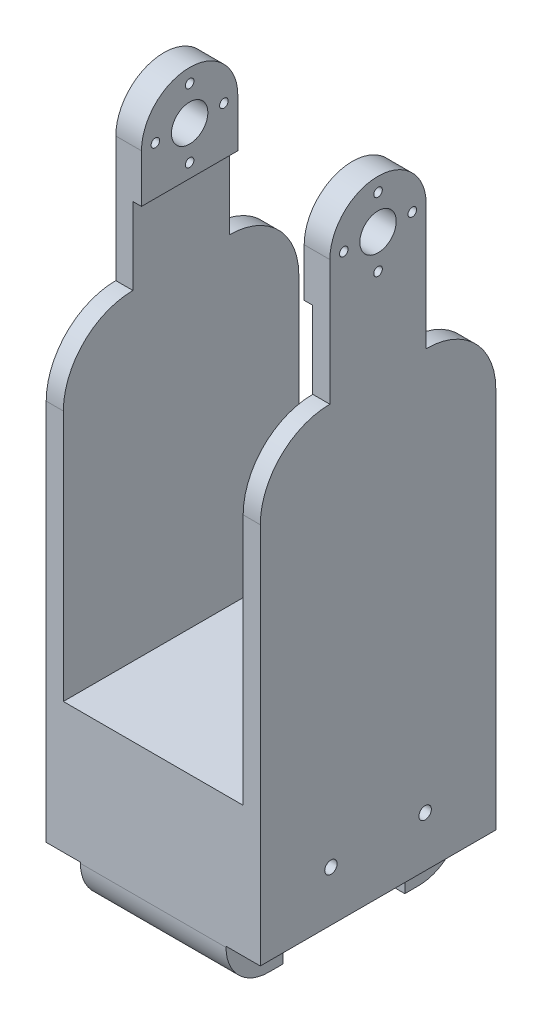
from build123d import *

# Parameters (mm, degrees)
SKETCH1_W           = 50
SKETCH1_H           = 170
BOSS_EXTRUDE1_DEPTH = 55
SKETCH2_W           = 34
SKETCH2_H           = 27
CUT_EXTRUDE1_DEPTH  = 181.416185527
SKETCH3_W           = 10
SKETCH3_H           = 24
SKETCH3_R           = 4.25
SKETCH3_R_2         = 1
CUT_EXTRUDE2_DEPTH  = 186.539753153
SKETCH4_W           = 2
SKETCH4_H           = 24
CUT_EXTRUDE3_DEPTH  = 178.623196683
SKETCH5_W           = 6.25
SKETCH5_H           = 11.25
CUT_EXTRUDE4_DEPTH  = 186.539753153
SKETCH6_W           = 38
SKETCH6_H           = 10
CUT_EXTRUDE5_DEPTH  = 181.416185527
SKETCH8_W           = 13.25
SKETCH8_H           = 2.25
CUT_EXTRUDE7_DEPTH  = 186.539753153
SKETCH9_W           = 34
SKETCH9_H           = 35.25
CUT_EXTRUDE8_DEPTH  = 179.297679458
SKETCH11_W          = 13.25
SKETCH11_H          = 20.25
CUT_EXTRUDE9_DEPTH  = 184.480414486
SKETCH12_W          = 28.5
SKETCH12_H          = 15
BOSS_EXTRUDE2_DEPTH = 8
SKETCH14_W          = 34
SKETCH14_H          = 15
SKETCH14_H_2        = 10.25
BOSS_EXTRUDE3_DEPTH = 13.25
SKETCH16_R          = 4.5
SKETCH16_R_2        = 2.5
CUT_EXTRUDE13_DEPTH = 8
SKETCH17_W          = 16.25
SKETCH17_H          = 18
CUT_EXTRUDE14_DEPTH = 175.384811552
CUT_EXTRUDE15_DEPTH = 175.384811552
SKETCH20_W          = 42
SKETCH20_H          = 6.25
SKETCH20_H_2        = 18
SKETCH20_H_3        = 58.75
CUT_EXTRUDE18_DEPTH = 169.923244404
SKETCH22_R          = 4.5
SKETCH22_R_2        = 1.45
BOSS_EXTRUDE4_DEPTH = 8
SKETCH23_W          = 2
SKETCH23_H          = 10
CUT_EXTRUDE19_DEPTH = 165.352137193
FILLET1_R           = 10


with BuildPart() as part:
    # Sketch1 → Boss-Extrude1 (new body)
    with BuildSketch(Plane.XY):
        with Locations((0, -85)):
            Rectangle(SKETCH1_W, SKETCH1_H)
    extrude(amount=-BOSS_EXTRUDE1_DEPTH)

    # Sketch2 → Cut-Extrude1 (cut, through all)
    with BuildSketch(Plane.XY):
        with Locations((0, -13.5)):
            Rectangle(SKETCH2_W, SKETCH2_H)
    extrude(amount=-CUT_EXTRUDE1_DEPTH, mode=Mode.SUBTRACT)

    # Sketch3 → Cut-Extrude2 (cut, through all)
    with BuildSketch(Plane(origin=(25, 0, 0), x_dir=(0, 0, -1), z_dir=(1, 0, 0))):
        with Locations((50, -12)):
            Rectangle(SKETCH3_W, SKETCH3_H)
        with Locations((5, -12)):
            Rectangle(SKETCH3_W, SKETCH3_H)
        with Locations(Location((27.5, -12.75, 0), (0, 0, 90))):
            Circle(SKETCH3_R)
        with Locations(Location((35.5, -12.75, 0), (0, 0, 90))):
            Circle(SKETCH3_R_2)
        with Locations(Location((27.5, -4.75, 0), (0, 0, 90))):
            Circle(SKETCH3_R_2)
        with Locations(Location((27.5, -20.75, 0), (0, 0, 90))):
            Circle(SKETCH3_R_2)
        with Locations(Location((19.5, -12.75, 0), (0, 0, 90))):
            Circle(SKETCH3_R_2)
    extrude(amount=-CUT_EXTRUDE2_DEPTH, mode=Mode.SUBTRACT)

    # Sketch4 → Cut-Extrude3 (cut, through all)
    with BuildSketch(Plane.XY.offset(-10)):
        with Locations((-18, -12)):
            Rectangle(SKETCH4_W, SKETCH4_H)
        with Locations((18, -12)):
            Rectangle(SKETCH4_W, SKETCH4_H)
    extrude(amount=-CUT_EXTRUDE3_DEPTH, mode=Mode.SUBTRACT)

    # Sketch5 → Cut-Extrude4 (cut, through all)
    with BuildSketch(Plane(origin=(25, 0, 0), x_dir=(0, 0, -1), z_dir=(1, 0, 0))):
        with BuildLine():
            Line((45, 0), (10, 0))
            Line((10, 0), (10, -12.75))
            Line((10, -12.75), (16.25, -12.75))
            ThreePointArc((16.25, -12.75), (27.5, -1.5), (38.75, -12.75))
            Line((38.75, -12.75), (45, -12.75))
            Line((45, -12.75), (45, 0))
        make_face()
        with Locations((13.125, -18.375)):
            Rectangle(SKETCH5_W, SKETCH5_H)
        with Locations((41.875, -18.375)):
            Rectangle(SKETCH5_W, SKETCH5_H)
    extrude(amount=-CUT_EXTRUDE4_DEPTH, mode=Mode.SUBTRACT)

    # Sketch6 → Cut-Extrude5 (cut, through all)
    with BuildSketch(Plane.XY):
        with Locations((0, -29)):
            Rectangle(SKETCH6_W, SKETCH6_H)
    extrude(amount=-CUT_EXTRUDE5_DEPTH, mode=Mode.SUBTRACT)

    # Sketch8 → Cut-Extrude7 (cut, through all)
    with BuildSketch(Plane(origin=(25, 0, 0), x_dir=(0, 0, -1), z_dir=(1, 0, 0))):
        with BuildLine():
            Line((27.5, -157.5), (27.5, -132.5))
            Line((27.5, -132.5), (13.25, -132.5))
            Line((13.25, -132.5), (13.25, -167.75))
            Line((13.25, -167.75), (17.25, -167.75))
            ThreePointArc((17.25, -167.75), (20.252155493, -160.502155493), (27.5, -157.5))
        make_face()
        with BuildLine():
            Line((41.75, -167.75), (41.75, -132.5))
            Line((41.75, -132.5), (27.5, -132.5))
            Line((27.5, -132.5), (27.5, -157.5))
            ThreePointArc((27.5, -157.5), (34.747844507, -160.502155493), (37.75, -167.75))
            Line((37.75, -167.75), (41.75, -167.75))
        make_face()
        with Locations((48.375, -168.875)):
            Rectangle(SKETCH8_W, SKETCH8_H)
        with Locations((6.625, -168.875)):
            Rectangle(SKETCH8_W, SKETCH8_H)
        with BuildLine():
            Line((17.25, -167.75), (13.25, -167.75))
            Line((13.25, -167.75), (13.25, -170))
            Line((13.25, -170), (17.5, -170))
            ThreePointArc((17.5, -170), (17.31269172, -168.881923142), (17.25, -167.75))
        make_face()
        with BuildLine():
            Line((41.75, -170), (41.75, -167.75))
            Line((41.75, -167.75), (37.75, -167.75))
            ThreePointArc((37.75, -167.75), (37.68730828, -168.881923142), (37.5, -170))
            Line((37.5, -170), (41.75, -170))
        make_face()
        with BuildLine():
            Line((27.5, -167.75), (27.5, -157.5))
            ThreePointArc((27.5, -157.5), (20.252155493, -160.502155493), (17.25, -167.75))
            Line((17.25, -167.75), (27.5, -167.75))
        make_face()
        with BuildLine():
            ThreePointArc((37.75, -167.75), (34.747844507, -160.502155493), (27.5, -157.5))
            Line((27.5, -157.5), (27.5, -167.75))
            Line((27.5, -167.75), (37.75, -167.75))
        make_face()
        with BuildLine():
            Line((27.5, -170), (27.5, -167.75))
            Line((27.5, -167.75), (17.25, -167.75))
            ThreePointArc((17.25, -167.75), (17.31269172, -168.881923142), (17.5, -170))
            Line((17.5, -170), (27.5, -170))
        make_face()
        with BuildLine():
            ThreePointArc((37.5, -170), (37.68730828, -168.881923142), (37.75, -167.75))
            Line((37.75, -167.75), (27.5, -167.75))
            Line((27.5, -167.75), (27.5, -170))
            Line((27.5, -170), (37.5, -170))
        make_face()
    extrude(amount=-CUT_EXTRUDE7_DEPTH, mode=Mode.SUBTRACT)

    # Sketch9 → Cut-Extrude8 (cut, through all)
    with BuildSketch(Plane.XY):
        with Locations((0, -150.125)):
            Rectangle(SKETCH9_W, SKETCH9_H)
    extrude(amount=-CUT_EXTRUDE8_DEPTH, mode=Mode.SUBTRACT)

    # Sketch11 → Cut-Extrude9 (cut, through all)
    with BuildSketch(Plane(origin=(25, 0, 0), x_dir=(0, 0, -1), z_dir=(1, 0, 0))):
        with BuildLine():
            ThreePointArc((17.25, -167.75), (20.252155493, -160.502155493), (27.5, -157.5))
            Line((27.5, -157.5), (27.5, -147.5))
            Line((27.5, -147.5), (13.25, -147.5))
            Line((13.25, -147.5), (13.25, -167.75))
            Line((13.25, -167.75), (17.25, -167.75))
        make_face()
        with BuildLine():
            Line((27.5, -147.5), (27.5, -157.5))
            ThreePointArc((27.5, -157.5), (34.747844507, -160.502155493), (37.75, -167.75))
            Line((37.75, -167.75), (41.75, -167.75))
            Line((41.75, -167.75), (41.75, -147.5))
            Line((41.75, -147.5), (27.5, -147.5))
        make_face()
        with Locations((48.375, -157.625)):
            Rectangle(SKETCH11_W, SKETCH11_H)
        with Locations((6.625, -157.625)):
            Rectangle(SKETCH11_W, SKETCH11_H)
    extrude(amount=-CUT_EXTRUDE9_DEPTH, mode=Mode.SUBTRACT)

    # Sketch12 → Boss-Extrude2 (add)
    with BuildSketch(Plane(origin=(25, 0, 0), x_dir=(0, 0, -1), z_dir=(1, 0, 0))):
        with Locations((27.5, -140)):
            Rectangle(SKETCH12_W, SKETCH12_H)
    boss_extrude2 = extrude(amount=-BOSS_EXTRUDE2_DEPTH)

    # Mirror1: Boss-Extrude2 across plane
    add(boss_extrude2.mirror(Plane(origin=(0, 0, 0), x_dir=(0, 0, 1), z_dir=(1, 0, 0))))

    # Sketch14 → Boss-Extrude3 (add)
    with BuildSketch(Plane.XY):
        with Locations((0, -140)):
            Rectangle(SKETCH14_W, SKETCH14_H)
        with Locations((0, -152.625)):
            Rectangle(SKETCH14_W, SKETCH14_H_2)
    boss_extrude3 = extrude(amount=-BOSS_EXTRUDE3_DEPTH)

    # Mirror2: Boss-Extrude3 across plane
    add(boss_extrude3.mirror(Plane.XY.offset(-27.5)))

    # Sketch16 → Cut-Extrude13 (cut)
    # profile 1 of 3: a face of its own
    with BuildSketch(Plane(origin=(25, 0, 0), x_dir=(0, 0, -1), z_dir=(1, 0, 0))):
        with Locations(Location((16.5, -135.75, 0), (0, 0, 90))):
            Circle(SKETCH16_R)
        with Locations((16.5, -135.75)):
            Circle(SKETCH16_R_2, mode=Mode.SUBTRACT)
    # profile 2 of 3: a face of its own
    with BuildSketch(Plane(origin=(25, 0, 0), x_dir=(0, 0, -1), z_dir=(1, 0, 0))):
        with Locations((16.5, -135.75)):
            Circle(SKETCH16_R_2)
    # profile 3 of 3: a face of its own
    with BuildSketch(Plane(origin=(25, 0, 0), x_dir=(0, 0, -1), z_dir=(1, 0, 0))):
        with Locations(Location((38.5, -135.75, 0), (0, 0, 90))):
            Circle(SKETCH16_R)
    cut_extrude13 = extrude(amount=-CUT_EXTRUDE13_DEPTH, mode=Mode.SUBTRACT)

    # Mirror3: Cut-Extrude13 across plane
    add(cut_extrude13.mirror(Plane(origin=(0, 0, 0), x_dir=(0, 0, 1), z_dir=(1, 0, 0))), mode=Mode.SUBTRACT)

    # Sketch17 → Cut-Extrude14 (cut, through all)
    with BuildSketch(Plane(origin=(25, 0, 0), x_dir=(0, 0, -1), z_dir=(1, 0, 0))):
        with Locations((46.875, -33)):
            Rectangle(SKETCH17_W, SKETCH17_H)
        with Locations((8.125, -33)):
            Rectangle(SKETCH17_W, SKETCH17_H)
    extrude(amount=-CUT_EXTRUDE14_DEPTH, mode=Mode.SUBTRACT)

    # Sketch18 → Cut-Extrude15 (cut, through all)
    with BuildSketch(Plane(origin=(25, 0, 0), x_dir=(0, 0, -1), z_dir=(1, 0, 0))):
        with BuildLine():
            ThreePointArc((0, -58.25), (4.759514806, -46.759514806), (16.25, -42))
            Line((16.25, -42), (0, -42))
            Line((0, -42), (0, -58.25))
        make_face()
        with BuildLine():
            Line((55, -42), (38.75, -42))
            ThreePointArc((38.75, -42), (50.240485194, -46.759514806), (55, -58.25))
            Line((55, -58.25), (55, -42))
        make_face()
    extrude(amount=-CUT_EXTRUDE15_DEPTH, mode=Mode.SUBTRACT)

    # Sketch20 → Cut-Extrude18 (cut, through all)
    with BuildSketch(Plane(origin=(0, 0, -55), x_dir=(-1, 0, 0), z_dir=(0, 0, -1))):
        with Locations((0, -55.125)):
            Rectangle(SKETCH20_W, SKETCH20_H)
        with Locations((0, -43)):
            Rectangle(SKETCH20_W, SKETCH20_H_2)
        with Locations((0, -87.625)):
            Rectangle(SKETCH20_W, SKETCH20_H_3)
    extrude(amount=-CUT_EXTRUDE18_DEPTH, mode=Mode.SUBTRACT)

    # Sketch22 → Boss-Extrude4 (add)
    # profile 1 of 2: a face of its own
    with BuildSketch(Plane.ZY.offset(25)):
        with Locations(Location((-38.5, -135.75, 0), (0, 0, 90))):
            Circle(SKETCH22_R)
        with Locations(Location((-38.5, -135.75, 0), (0, 0, 270))):
            Circle(SKETCH22_R_2, mode=Mode.SUBTRACT)
    # profile 2 of 2: a face of its own
    with BuildSketch(Plane.ZY.offset(25)):
        with Locations(Location((-16.5, -135.75, 0), (0, 0, 90))):
            Circle(SKETCH22_R)
        with Locations(Location((-16.5, -135.75, 0), (0, 0, 270))):
            Circle(SKETCH22_R_2, mode=Mode.SUBTRACT)
    boss_extrude4 = extrude(amount=-BOSS_EXTRUDE4_DEPTH)

    # Mirror4: Boss-Extrude4 across plane
    add(boss_extrude4.mirror(Plane(origin=(0, 0, 0), x_dir=(0, 0, 1), z_dir=(1, 0, 0))))

    # Sketch23 → Cut-Extrude19 (cut, through all)
    with BuildSketch(Plane(origin=(0, 0, -38.75), x_dir=(-1, 0, 0), z_dir=(0, 0, -1))):
        with Locations((-20, -29)):
            Rectangle(SKETCH23_W, SKETCH23_H)
        with Locations((20, -29)):
            Rectangle(SKETCH23_W, SKETCH23_H)
    extrude(amount=-CUT_EXTRUDE19_DEPTH, mode=Mode.SUBTRACT)

    # Fillet1
    fillet1_edges = [part.edges().sort_by_distance(p)[0] for p in [
        (0, -157.75, 0),
        (0, -157.75, -55),
    ]]
    fillet(fillet1_edges, radius=FILLET1_R)


solid = part.part
